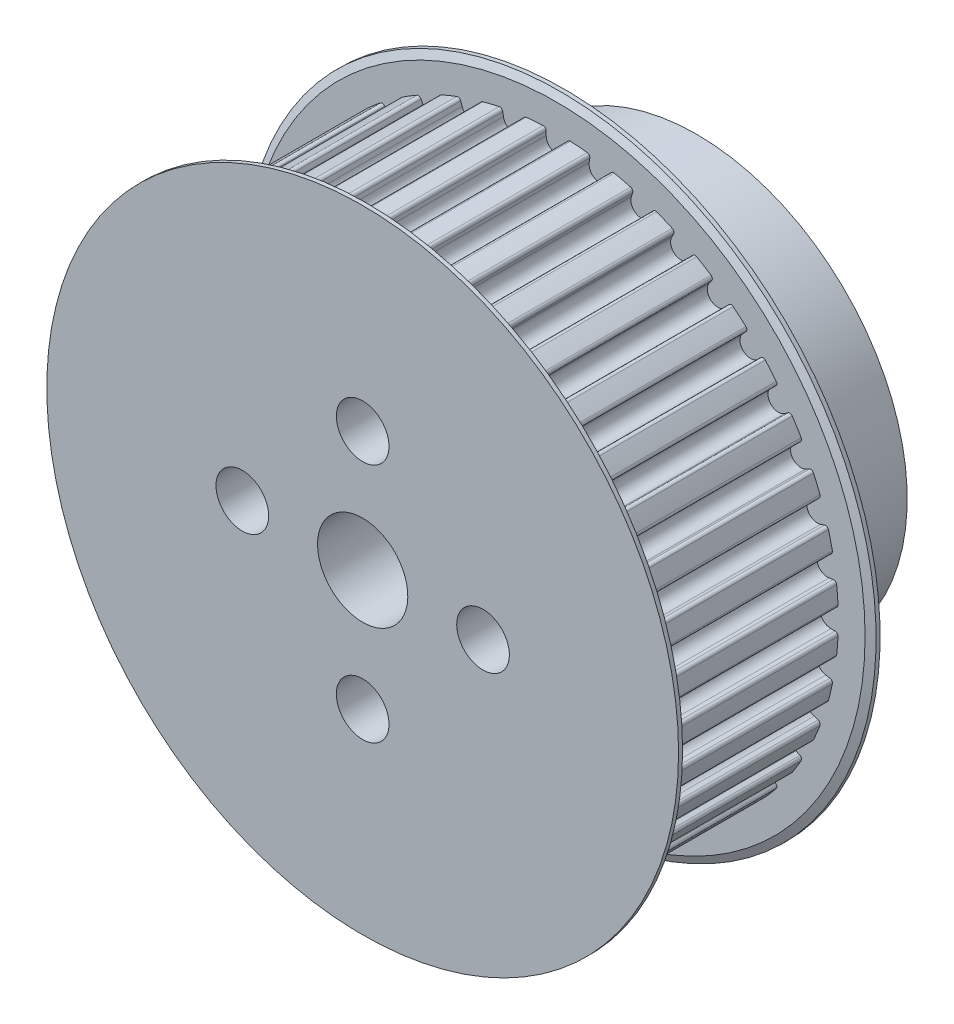
from build123d import *

# Parameters (mm, degrees)
SKETCH5_W           = 13.4
SKETCH5_H           = 18.72
SKETCH16_W          = 8.8
SKETCH16_H          = 14
SKETCH17_W          = 22.2
SKETCH17_H          = 3
CUT_TOOTH_REACH     = 36.55
PATTERN_TOOTH_COUNT = 40
SKETCH_1_R          = 1.5
CUT_EXTRUDE_1_DEPTH = 23.5
SKETCH_2_R          = 1.75
CUT_EXTRUDE_2_DEPTH = 39


with BuildPart() as part:
    # Sketch5 → body (revolve)
    with BuildSketch(Plane(origin=(0, 0, 0), x_dir=(0, 0, -1), z_dir=(1, 0, 0))):
        with Locations((6.7, 9.36)):
            Rectangle(SKETCH5_W, SKETCH5_H)
    revolve(axis=Axis((0, 0, 0), (0, 0, -1)))

    # Sketch16 → body-hub (revolve)
    with BuildSketch(Plane(origin=(0, 0, 0), x_dir=(0, 0, -1), z_dir=(1, 0, 0))):
        with Locations((17.8, 7)):
            Rectangle(SKETCH16_W, SKETCH16_H)
    revolve(axis=Axis((0, 0, -22.2), (0, 0, 1)))

    # Sketch17 → body-bore (revolve, cut)
    with BuildSketch(Plane(origin=(0, 0, 0), x_dir=(0, 0, -1), z_dir=(1, 0, 0))):
        with Locations((11.1, 1.5)):
            Rectangle(SKETCH17_W, SKETCH17_H)
    revolve(axis=Axis((0, 0, -22.2), (0, 0, 1)), mode=Mode.SUBTRACT)

    # Sketch23 → cut-tooth (cut, up to next)
    with BuildSketch(Plane.XY, mode=Mode.PRIVATE) as cut_tooth_sk1:
        with BuildLine():
            Line((0.7, 18.22), (0.7, 18.498118823))
            ThreePointArc((0.7, 18.498118823), (0.762057701, 18.642935681), (0.909719222, 18.697882525))
            Line((0.909719222, 18.697882525), (0.909719222, 19.875765051))
            Line((0.909719222, 19.875765051), (-0.909719222, 19.875765051))
            Line((-0.909719222, 19.875765051), (-0.909719222, 18.697882525))
            ThreePointArc((-0.909719222, 18.697882525), (-0.762057701, 18.642935681), (-0.7, 18.498118823))
            Line((-0.7, 18.498118823), (-0.7, 18.22))
            ThreePointArc((-0.7, 18.22), (0, 17.52), (0.7, 18.22))
        make_face()
    cut_tooth_tool1 = extrude(cut_tooth_sk1.sketch, amount=-CUT_TOOTH_REACH, mode=Mode.PRIVATE) & part.part
    cut_tooth = cut_tooth_tool1.solids().sort_by_distance((0, 18.838215, 0))[0]
    add(cut_tooth, mode=Mode.SUBTRACT)

    # pattern-tooth: cut-tooth ×40 about axis
    pattern_tooth_axis = Axis((0, 0, -13.4), (0, 0, 1))
    for i in range(1, PATTERN_TOOTH_COUNT):
        add(cut_tooth.rotate(pattern_tooth_axis, i * 360 / PATTERN_TOOTH_COUNT), mode=Mode.SUBTRACT)

    # Sketch25 → body-flange-front (revolve)
    with BuildSketch(Plane(origin=(0, 0, 0), x_dir=(0, 0, -1), z_dir=(1, 0, 0))):
        Polygon((0.5, 9.37375), (0, 9.37375), (0, 17.124583333), (0, 21), (0.5, 21), (0.5, 17.124583333), align=None)
    revolve(axis=Axis((0, 0, 0), (0, 0, -1)))

    # Sketch26 → body-flange-back (revolve)
    with BuildSketch(Plane(origin=(0, 0, 0), x_dir=(0, 0, -1), z_dir=(1, 0, 0))):
        Polygon((12.9, 9.37375), (13.4, 9.37375), (13.4, 17.124583333), (13.4, 21), (12.9, 21), (12.9, 17.124583333), align=None)
    revolve(axis=Axis((0, 0, -13.4), (0, 0, 1)))

    # Sketch28 → body-flange-profile-front (revolve, cut)
    with BuildSketch(Plane(origin=(0, 0, 0), x_dir=(0, 0, -1), z_dir=(1, 0, 0))):
        Polygon((0.5, 21), (0.5, 20.5), (0.266846171, 21), align=None)
    revolve(axis=Axis((0, 0, -13.4), (0, 0, 1)), mode=Mode.SUBTRACT)

    # Sketch29 → body-flange-profile-back (revolve, cut)
    with BuildSketch(Plane(origin=(0, 0, 0), x_dir=(0, 0, -1), z_dir=(1, 0, 0))):
        Polygon((12.9, 21), (12.9, 20.5), (13.133153829, 21), align=None)
    revolve(axis=Axis((0, 0, -13.4), (0, 0, 1)), mode=Mode.SUBTRACT)

    # 草图1 → 切除-拉伸1 (cut)
    with BuildSketch(Plane(origin=(0, 0, 0), x_dir=(1, 0, 0), z_dir=(0, 1, 0))):
        with Locations((0, 17.7)):
            Circle(SKETCH_1_R)
    extrude(amount=-CUT_EXTRUDE_1_DEPTH, mode=Mode.SUBTRACT)

    # 草图2 → 切除-拉伸2 (cut)
    with BuildSketch(Plane(origin=(0, 0, -22.2), x_dir=(-1, 0, 0), z_dir=(0, 0, -1))):
        with Locations((0, -8)):
            Circle(SKETCH_2_R)
        with Locations((-8, 0)):
            Circle(SKETCH_2_R)
        with Locations((0, 8)):
            Circle(SKETCH_2_R)
        with Locations((8, 0)):
            Circle(SKETCH_2_R)
    extrude(amount=-CUT_EXTRUDE_2_DEPTH, mode=Mode.SUBTRACT)


solid = part.part
